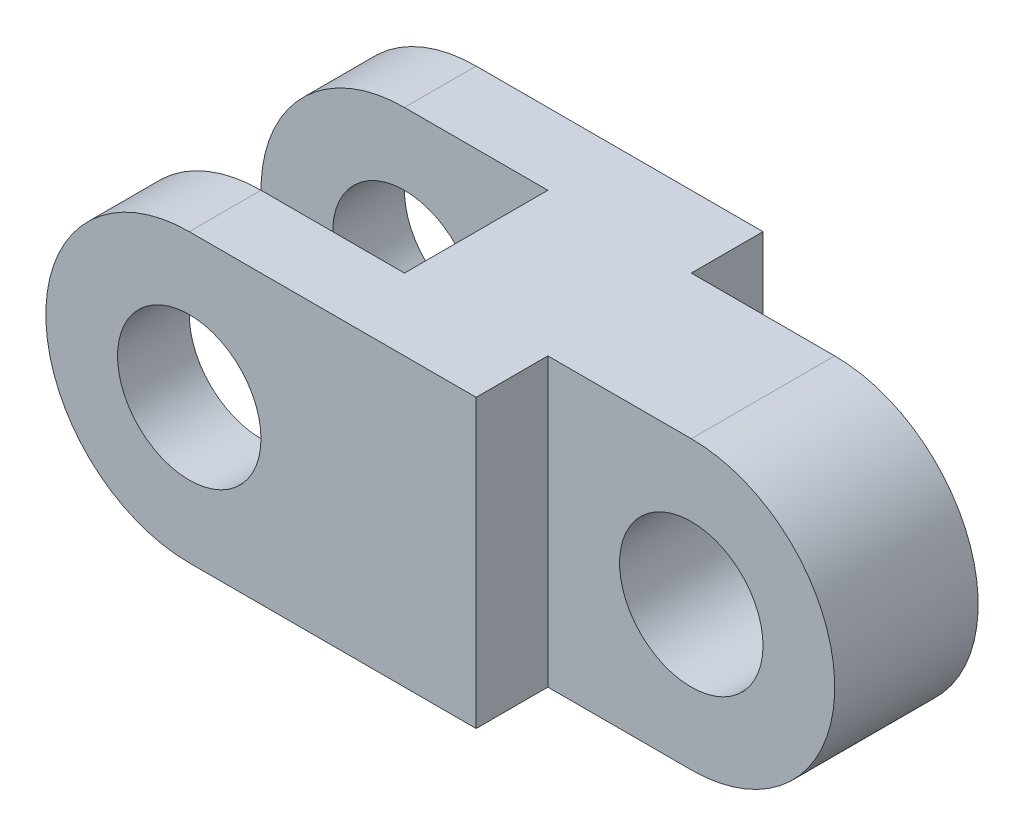
from build123d import *

# Parameters (mm, degrees)
BOSS_EXTRUDE1_DEPTH     = 50
CUT_EXTRUDE1_DEPTH      = 25
SKETCH7_W               = 50
SKETCH7_H               = 50
CUT_EXTRUDE2_DEPTH      = 168.705098312
CUT_EXTRUDE3_DEPTH      = 168.705098312
CUT_EXTRUDE3_DEPTH_BACK = 168.705098312
SKETCH8_R               = 25
CUT_EXTRUDE4_DEPTH      = 168.705098312
CUT_EXTRUDE4_DEPTH_BACK = 168.705098312
SKETCH9_R               = 25
SKETCH15_R              = 25
CUT_EXTRUDE5_DEPTH      = 25


with BuildPart() as part:
    # Sketch2 → Boss-Extrude1 (new, symmetric)
    with BuildSketch(Plane.XY):
        with BuildLine():
            ThreePointArc((-75, 50), (-125, 0), (-75, -50))
            Line((-75, -50), (-75, 50))
        make_face()
        with BuildLine():
            Line((-75, 50), (-75, -50))
            ThreePointArc((-75, -50), (-39.644660941, -35.355339059), (-25, 0))
            ThreePointArc((-25, 0), (-39.644660941, 35.355339059), (-75, 50))
        make_face()
        with BuildLine():
            ThreePointArc((-75, 50), (-125, 0), (-75, -50))
            Line((-75, -50), (-75, 50))
        make_face()
        with BuildLine():
            Line((-75, 50), (-75, -50))
            ThreePointArc((-75, -50), (-39.644660941, -35.355339059), (-25, 0))
            ThreePointArc((-25, 0), (-39.644660941, 35.355339059), (-75, 50))
        make_face()
        with BuildLine():
            ThreePointArc((-25, 0), (-39.644660941, -35.355339059), (-75, -50))
            Line((-75, -50), (75, -50))
            ThreePointArc((75, -50), (25, 0), (75, 50))
            Line((75, 50), (-75, 50))
            ThreePointArc((-75, 50), (-39.644660941, 35.355339059), (-25, 0))
        make_face()
        with BuildLine():
            ThreePointArc((75, 50), (25, 0), (75, -50))
            Line((75, -50), (75, 50))
        make_face()
        with BuildLine():
            Line((75, 50), (75, -50))
            ThreePointArc((75, -50), (110.355339059, -35.355339059), (125, 0))
            ThreePointArc((125, 0), (110.355339059, 35.355339059), (75, 50))
        make_face()
        with BuildLine():
            ThreePointArc((75, 50), (25, 0), (75, -50))
            Line((75, -50), (75, 50))
        make_face()
        with BuildLine():
            Line((75, 50), (75, -50))
            ThreePointArc((75, -50), (110.355339059, -35.355339059), (125, 0))
            ThreePointArc((125, 0), (110.355339059, 35.355339059), (75, 50))
        make_face()
    extrude(amount=BOSS_EXTRUDE1_DEPTH, both=True)

    # Sketch4 → Cut-Extrude1 (cut, symmetric)
    with BuildSketch(Plane.XY):
        with BuildLine():
            Line((-75, -50), (-75, 50))
            ThreePointArc((-75, 50), (-125, 0), (-75, -50))
        make_face()
    extrude(amount=CUT_EXTRUDE1_DEPTH, both=True, mode=Mode.SUBTRACT)

    # Sketch7 → Cut-Extrude2 (cut, through all)
    with BuildSketch(Plane(origin=(0, 50, 0), x_dir=(1, 0, 0), z_dir=(0, 1, 0))):
        with Locations((-50, 0)):
            Rectangle(SKETCH7_W, SKETCH7_H)
    extrude(amount=-CUT_EXTRUDE2_DEPTH, mode=Mode.SUBTRACT)

    # Sketch8 → Cut-Extrude3 (cut, two sides: drawn at the far end of the back side and taken through both)
    with BuildSketch(Plane.XY.offset(50).offset(-CUT_EXTRUDE3_DEPTH_BACK)):
        with Locations((-75, 0)):
            Circle(SKETCH8_R)
    extrude(amount=CUT_EXTRUDE3_DEPTH + CUT_EXTRUDE3_DEPTH_BACK, mode=Mode.SUBTRACT)

    # Sketch9 → Cut-Extrude4 (cut, two sides: drawn at the far end of the back side and taken through both)
    with BuildSketch(Plane.XY.offset(50).offset(-CUT_EXTRUDE4_DEPTH_BACK)):
        with Locations((75, 0)):
            Circle(SKETCH9_R)
    extrude(amount=CUT_EXTRUDE4_DEPTH + CUT_EXTRUDE4_DEPTH_BACK, mode=Mode.SUBTRACT)

    # Sketch15 → Cut-Extrude5 (cut)
    with BuildSketch(Plane.XY.offset(50)):
        with BuildLine():
            Line((75, 50), (25, 50))
            Line((25, 50), (25, -50))
            Line((25, -50), (75, -50))
            ThreePointArc((75, -50), (125, 0), (75, 50))
        make_face()
        with Locations((75, 0)):
            Circle(SKETCH15_R, mode=Mode.SUBTRACT)
    cut_extrude5 = extrude(amount=-CUT_EXTRUDE5_DEPTH, mode=Mode.SUBTRACT)

    # Mirror1: Cut-Extrude5 across plane
    add(cut_extrude5.mirror(Plane.XY), mode=Mode.SUBTRACT)


solid = part.part
